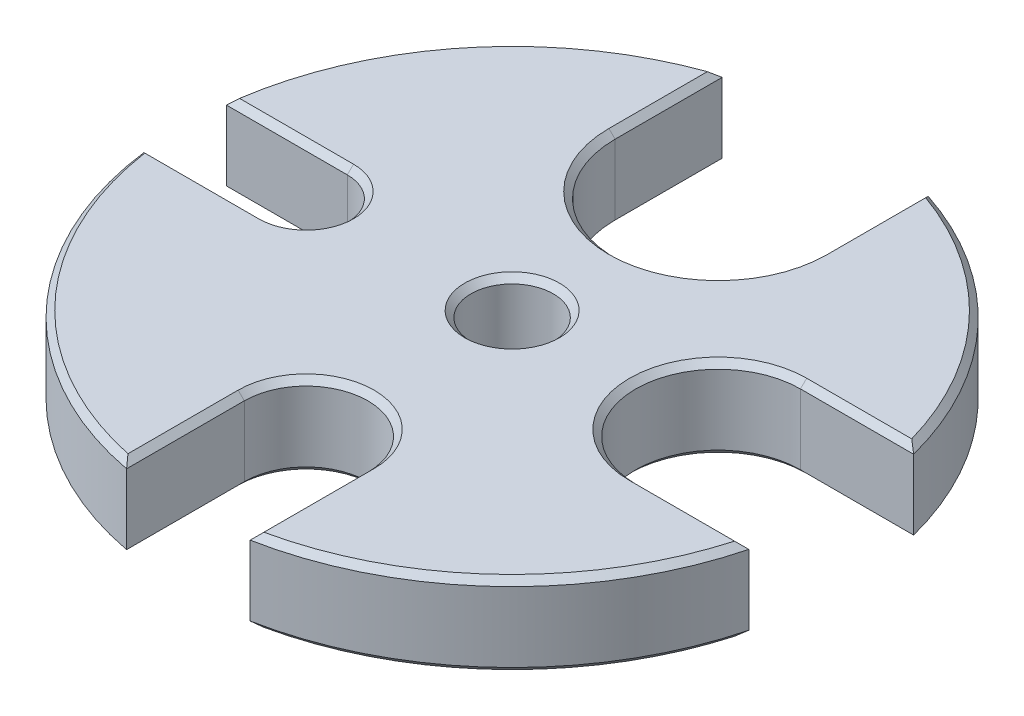
from build123d import *

# Parameters (mm, degrees)
SKETCH2_R           = 12.7
BOSS_EXTRUDE1_DEPTH = 25.4
CHAMFER1_SIZE       = 1.905


with BuildPart() as part:
    # Sketch2 → Boss-Extrude1 (new body)
    with BuildSketch(Plane(origin=(0, 0, 0), x_dir=(1, 0, 0), z_dir=(0, 1, 0))):
        with BuildLine():
            Line((63.5, 25.4), (98.373776994, 25.4))
            ThreePointArc((98.373776994, 25.4), (74.143548783, 69.464337424), (31.75, 96.511644375))
            Line((31.75, 96.511644375), (31.75, 63.5))
            ThreePointArc((31.75, 63.5), (0, 31.75), (-31.75, 63.5))
            Line((-31.75, 63.5), (-31.75, 96.511644375))
            ThreePointArc((-31.75, 96.511644375), (-78.413523495, 64.605567354), (-100.803124952, 12.7))
            Line((-100.803124952, 12.7), (-63.5, 12.7))
            ThreePointArc((-63.5, 12.7), (-50.8, 0), (-63.5, -12.7))
            Line((-63.5, -12.7), (-100.803124952, -12.7))
            ThreePointArc((-100.803124952, -12.7), (-74.079092421, -69.533071743), (-19.05, -99.798083649))
            Line((-19.05, -99.798083649), (-19.05, -63.5))
            ThreePointArc((-19.05, -63.5), (0, -44.45), (19.05, -63.5))
            Line((19.05, -63.5), (19.05, -99.798083649))
            ThreePointArc((19.05, -99.798083649), (69.504349242, -74.106041835), (98.373776994, -25.4))
            Line((98.373776994, -25.4), (63.5, -25.4))
            ThreePointArc((63.5, -25.4), (38.1, 0), (63.5, 25.4))
        make_face()
        with Locations(Location((0, 0, 0), (0, 0, 270))):
            Circle(SKETCH2_R, mode=Mode.SUBTRACT)
    extrude(amount=BOSS_EXTRUDE1_DEPTH)

    # Chamfer1
    chamfer1_edges = [part.edges().sort_by_distance(p)[0] for p in [
        (74.143548783, 25.4, -69.464337424),
        (80.936888497, 0, 25.4),
        (69.504349242, 0, 74.106041835),
        (19.05, 0, 81.649041824),
        (31.75, 25.4, -80.005822188),
        (0, 0, 44.45),
        (-19.05, 0, 81.649041824),
        (-74.079092421, 0, 69.533071743),
        (-82.151562476, 0, 12.7),
        (-50.8, 0, 0),
        (-82.151562476, 0, -12.7),
        (-78.413523495, 0, -64.605567354),
        (-31.75, 0, -80.005822188),
        (0, 0, -31.75),
        (31.75, 0, -80.005822188),
        (0, 25.4, -31.75),
        (74.143548783, 0, -69.464337424),
        (80.936888497, 0, -25.4),
        (38.1, 0, 0),
        (-31.75, 25.4, -80.005822188),
        (-78.413523495, 25.4, -64.605567354),
        (-82.151562476, 25.4, -12.7),
        (-50.8, 25.4, 0),
        (0, 0, -12.7),
        (0, 25.4, -12.7),
        (-82.151562476, 25.4, 12.7),
        (-74.079092421, 25.4, 69.533071743),
        (-19.05, 25.4, 81.649041824),
        (38.1, 25.4, 0),
        (0, 25.4, 44.45),
        (19.05, 25.4, 81.649041824),
        (69.504349242, 25.4, 74.106041835),
        (80.936888497, 25.4, 25.4),
        (80.936888497, 25.4, -25.4),
    ]]
    chamfer(chamfer1_edges, length=CHAMFER1_SIZE)


solid = part.part
